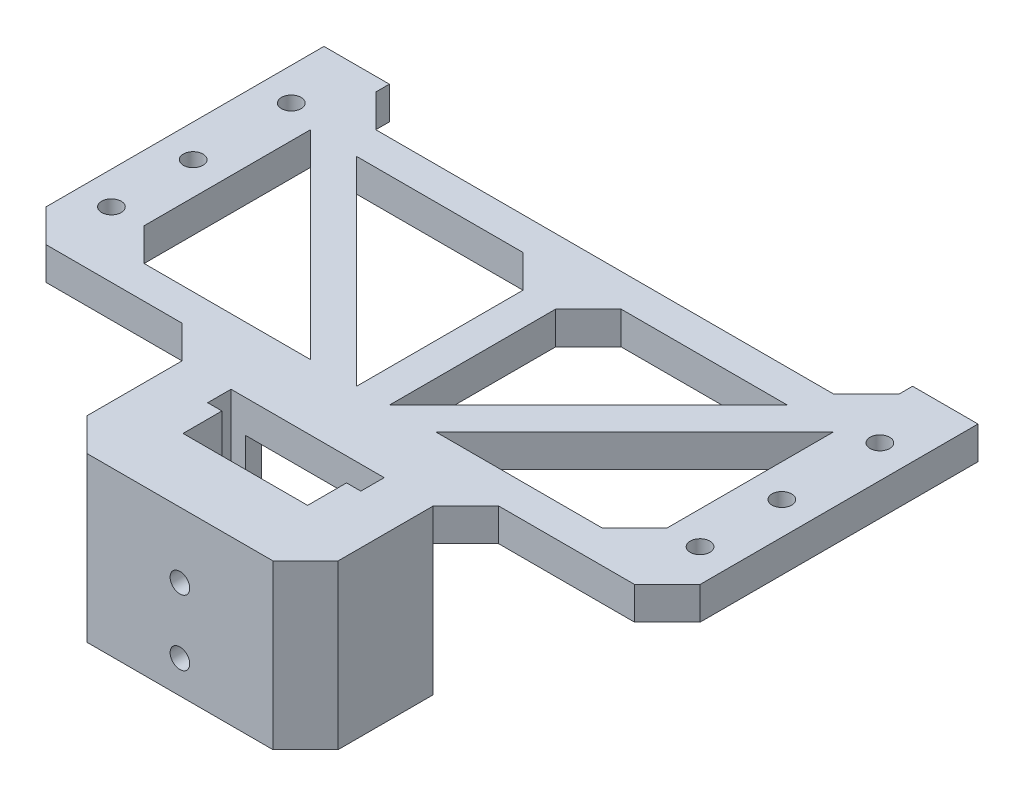
from build123d import *

# Parameters (mm, degrees)
SKETCH1_R           = 1.5
BOSS_EXTRUDE1_DEPTH = 5
BOSS_EXTRUDE2_DEPTH = 20
CUT_EXTRUDE1_REACH  = 84.141
SKETCH3_R           = 1.5


with BuildPart() as part:
    # Sketch1 → Boss-Extrude1 (new body)
    with BuildSketch(Plane(origin=(0, 0, 0), x_dir=(1, 0, 0), z_dir=(0, 1, 0))):
        Polygon((-14.2078125, 0), (14.2078125, 0), (19.2078125, 5), (19.2078125, 19.525), (24.2078125, 24.525), (45, 24.525), (50, 29.525), (50, 72.025), (40, 72.025), (40, 69.953932188), (35, 64.953932188), (-35, 64.953932188), (-40, 69.953932188), (-40, 72.025), (-50, 72.025), (-50, 29.525), (-45, 24.525), (-24.2078125, 24.525), (-19.2078125, 19.525), (-19.2078125, 5), align=None)
        with Locations(Location((45, 34.525, 0), (0, 0, 270))):
            Circle(SKETCH1_R, mode=Mode.SUBTRACT)
        with Locations(Location((45, 47.025, 0), (0, 0, 270))):
            Circle(SKETCH1_R, mode=Mode.SUBTRACT)
        with Locations(Location((45, 62.025, 0), (0, 0, 270))):
            Circle(SKETCH1_R, mode=Mode.SUBTRACT)
        with Locations(Location((-45, 62.025, 0), (0, 0, 90))):
            Circle(SKETCH1_R, mode=Mode.SUBTRACT)
        with Locations(Location((-45, 47.025, 0), (0, 0, 90))):
            Circle(SKETCH1_R, mode=Mode.SUBTRACT)
        with Locations(Location((-45, 34.525, 0), (0, 0, 90))):
            Circle(SKETCH1_R, mode=Mode.SUBTRACT)
        Polygon((-9.525, 10), (9.525, 10), (9.525, 15.953125), (11.7078125, 15.953125), (11.7078125, 19.525), (-11.7078125, 19.525), (-11.7078125, 15.953125), (-9.525, 15.953125), align=None, mode=Mode.SUBTRACT)
        Polygon((2.5, 54.953932188), (2.5, 29.525), (32.928932188, 59.953932188), (7.5, 59.953932188), align=None, mode=Mode.SUBTRACT)
        Polygon((40, 59.953932188), (9.571067812, 29.525), (35, 29.525), (40, 34.525), align=None, mode=Mode.SUBTRACT)
        Polygon((-40, 34.525), (-40, 59.953932188), (-9.571067812, 29.525), (-35, 29.525), align=None, mode=Mode.SUBTRACT)
        Polygon((-2.5, 29.525), (-32.928932188, 59.953932188), (-7.5, 59.953932188), (-2.5, 54.953932188), align=None, mode=Mode.SUBTRACT)
    extrude(amount=BOSS_EXTRUDE1_DEPTH)

    # Sketch2 → Boss-Extrude2 (add)
    with BuildSketch(Plane(origin=(0, 0, 0), x_dir=(1, 0, 0), z_dir=(0, 1, 0))):
        Polygon((19.2078125, 19.525), (19.2078125, 5), (14.2078125, 0), (-14.2078125, 0), (-19.2078125, 5), (-19.2078125, 19.525), (-16.7078125, 22.025), (-9.525, 22.025), (-9.525, 19.525), (-11.7078125, 19.525), (-11.7078125, 15.953125), (-9.525, 15.953125), (-9.525, 10), (9.525, 10), (9.525, 15.953125), (11.7078125, 15.953125), (11.7078125, 19.525), (9.525, 19.525), (9.525, 22.025), (16.7078125, 22.025), align=None)
    extrude(amount=-BOSS_EXTRUDE2_DEPTH)

    # Sketch3 → Cut-Extrude1 (cut, up to next)
    with BuildSketch(Plane(origin=(0, 0, -10), x_dir=(-1, 0, 0), z_dir=(0, 0, -1)), mode=Mode.PRIVATE) as cut_extrude1_sk1:
        with Locations((0, -15)):
            Circle(SKETCH3_R)
    cut_extrude1_tool1 = extrude(cut_extrude1_sk1.sketch, amount=-CUT_EXTRUDE1_REACH, mode=Mode.PRIVATE) & part.part
    # Sketch3 → Cut-Extrude1 (cut, up to next)
    with BuildSketch(Plane(origin=(0, 0, -10), x_dir=(-1, 0, 0), z_dir=(0, 0, -1)), mode=Mode.PRIVATE) as cut_extrude1_sk2:
        with Locations((0, -5)):
            Circle(SKETCH3_R)
    cut_extrude1_tool2 = extrude(cut_extrude1_sk2.sketch, amount=-CUT_EXTRUDE1_REACH, mode=Mode.PRIVATE) & part.part
    add(cut_extrude1_tool1.solids().sort_by_distance((0, -15, -10))[0], mode=Mode.SUBTRACT)
    add(cut_extrude1_tool2.solids().sort_by_distance((0, -5, -10))[0], mode=Mode.SUBTRACT)


solid = part.part
